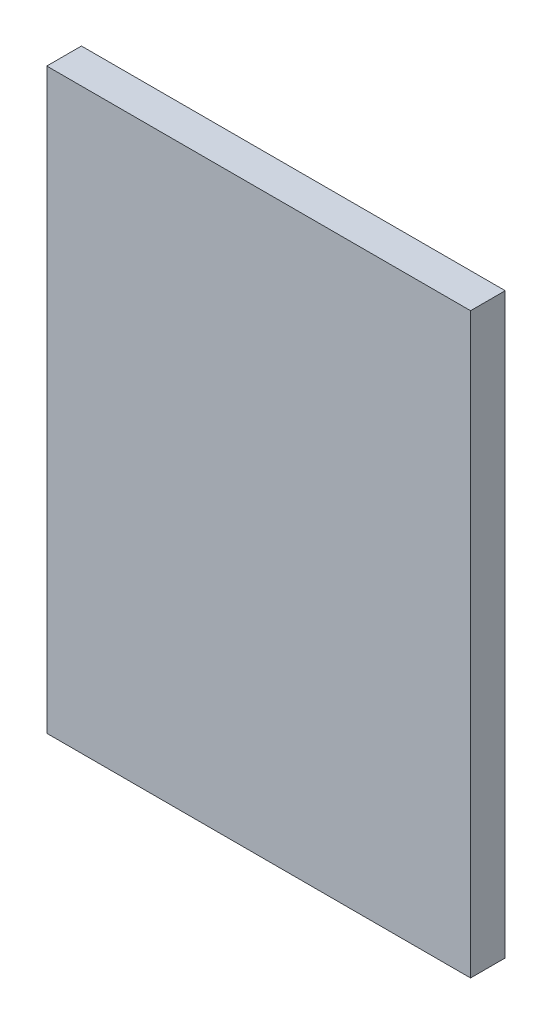
from build123d import *

# Parameters (mm, degrees)
SKETCH1_W           = 220
SKETCH1_H           = 300
BOSS_EXTRUDE1_DEPTH = 18


with BuildPart() as part:
    # Sketch1 → Boss-Extrude1 (new body)
    with BuildSketch(Plane.XY):
        Rectangle(SKETCH1_W, SKETCH1_H)
    extrude(amount=BOSS_EXTRUDE1_DEPTH)


solid = part.part
